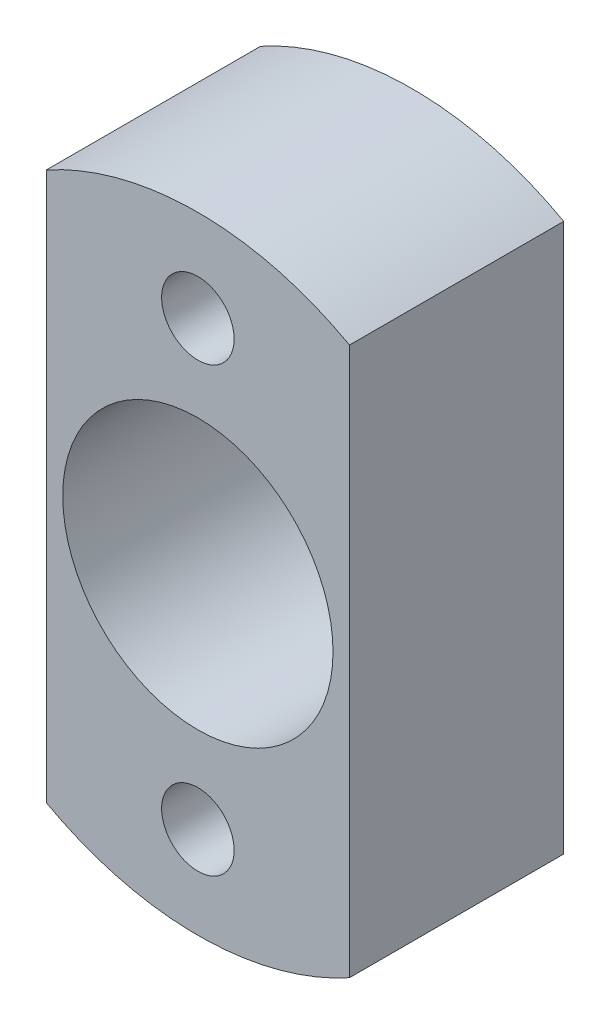
from build123d import *

# Parameters (mm, degrees)
EXTRUDE1_DEPTH     = 6.5
SKETCH3_R          = 1.1
CUT_EXTRUDE1_DEPTH = 13.395967086
SKETCH5_R          = 4.1
CUT_EXTRUDE2_DEPTH = 24


with BuildPart() as part:
    # Sketch1 → Extrude1 (new body)
    with BuildSketch(Plane.XY):
        with BuildLine():
            Line((-4.6, -8.312039461), (-4.6, 8.312039461))
            ThreePointArc((-4.6, 8.312039461), (0, 9.5), (4.6, 8.312039461))
            Line((4.6, 8.312039461), (4.6, -8.312039461))
            ThreePointArc((4.6, -8.312039461), (0, -9.5), (-4.6, -8.312039461))
        make_face()
    extrude(amount=EXTRUDE1_DEPTH)

    # Sketch3 → Cut-Extrude1 (cut, through all)
    with BuildSketch(Plane.XY.offset(6.5)):
        with Locations((0, 6.715)):
            Circle(SKETCH3_R)
        with Locations((0, -6.715)):
            Circle(SKETCH3_R)
    extrude(amount=-CUT_EXTRUDE1_DEPTH, mode=Mode.SUBTRACT)

    # Sketch5 → Cut-Extrude2 (cut)
    with BuildSketch(Plane(origin=(0, 0, 0), x_dir=(-1, 0, 0), z_dir=(0, 0, -1))):
        Circle(SKETCH5_R)
    extrude(amount=-CUT_EXTRUDE2_DEPTH, mode=Mode.SUBTRACT)


solid = part.part
